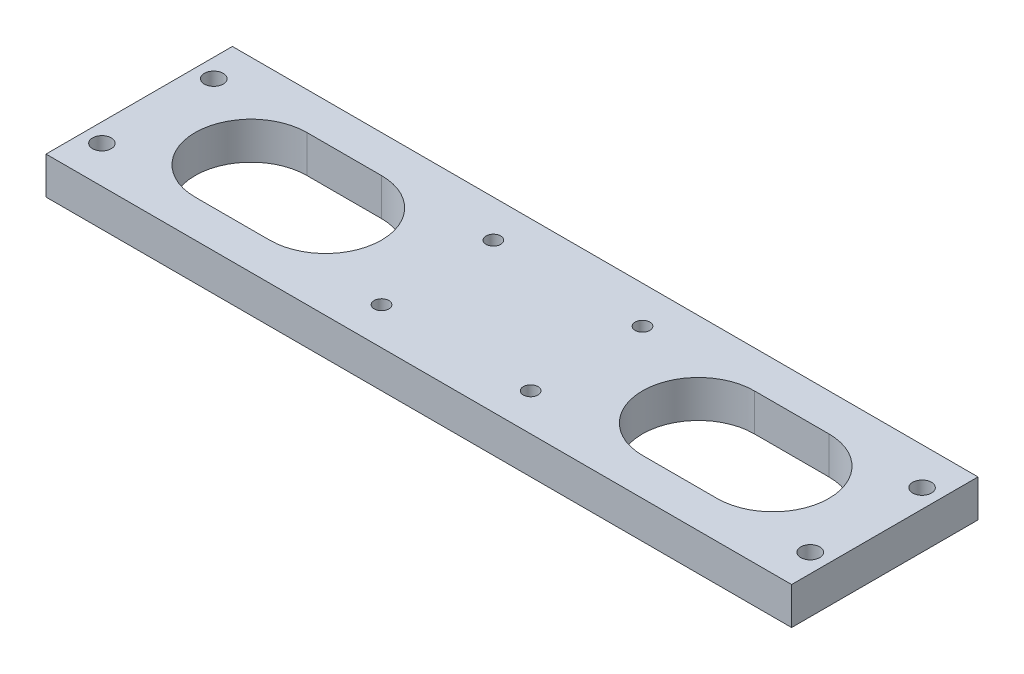
from build123d import *

# Parameters (mm, degrees)
SKETCH1_W                                       = 127
SKETCH1_H                                       = 31.75
BOSS_EXTRUDE1_DEPTH                             = 3.175
CSK_FOR_M3_FLAT_HEAD_MACHINE_SCREW1_D           = 3.2
CSK_FOR_M3_FLAT_HEAD_MACHINE_SCREW1_DEPTH       = 12.7
CSK_FOR_M3_FLAT_HEAD_MACHINE_SCREW1_CSINK_D     = 6.3
CSK_FOR_M3_FLAT_HEAD_MACHINE_SCREW1_CSINK_ANGLE = 90
CSK_FOR_M3_FLAT_HEAD_MACHINE_SCREW1_TIP         = 0.96137699
M3X0_5_TAPPED_HOLE1_D                           = 2.5
CUT_EXTRUDE1_DEPTH                              = 66.761600688


with BuildPart() as part:
    # Sketch1 → Boss-Extrude1 (new, symmetric)
    with BuildSketch(Plane(origin=(0, 0, 0), x_dir=(1, 0, 0), z_dir=(0, 1, 0))):
        Rectangle(SKETCH1_W, SKETCH1_H)
    extrude(amount=BOSS_EXTRUDE1_DEPTH, both=True)

    # CSK for M3 Flat Head Machine Screw1
    with Locations(Plane(origin=(0, -3.175, 0), x_dir=(-1, 0, 0), z_dir=(0, -1, 0))):
        with Locations((60.325, 9.525), (60.325, -9.525), (-60.325, -9.525), (-60.325, 9.525)):
            CounterSinkHole(CSK_FOR_M3_FLAT_HEAD_MACHINE_SCREW1_D / 2, CSK_FOR_M3_FLAT_HEAD_MACHINE_SCREW1_CSINK_D / 2, depth=CSK_FOR_M3_FLAT_HEAD_MACHINE_SCREW1_DEPTH, counter_sink_angle=CSK_FOR_M3_FLAT_HEAD_MACHINE_SCREW1_CSINK_ANGLE)
            with Locations((0, 0, -(CSK_FOR_M3_FLAT_HEAD_MACHINE_SCREW1_DEPTH + CSK_FOR_M3_FLAT_HEAD_MACHINE_SCREW1_TIP / 2))):  # 118° drill point
                Cone(0, CSK_FOR_M3_FLAT_HEAD_MACHINE_SCREW1_D / 2, CSK_FOR_M3_FLAT_HEAD_MACHINE_SCREW1_TIP, mode=Mode.SUBTRACT)

    # M3x0.5 Tapped Hole1 (through all)
    with Locations(Plane(origin=(0, 3.175, 0), x_dir=(1, 0, 0), z_dir=(0, 1, 0))):
        with Locations((-12.7, 9.525), (12.7, 9.525), (12.7, -9.525), (-12.7, -9.525)):
            Hole(M3X0_5_TAPPED_HOLE1_D / 2)

    # Sketch10 → Cut-Extrude1 (cut, through all)
    with BuildSketch(Plane(origin=(0, 3.175, 0), x_dir=(1, 0, 0), z_dir=(0, 1, 0))):
        with BuildLine():
            Line((-44.45, 9.525), (-31.75, 9.525))
            ThreePointArc((-31.75, 9.525), (-22.225, 0), (-31.75, -9.525))
            Line((-31.75, -9.525), (-44.45, -9.525))
            ThreePointArc((-44.45, -9.525), (-53.975, 0), (-44.45, 9.525))
        make_face()
        with BuildLine():
            Line((44.45, -9.525), (31.75, -9.525))
            ThreePointArc((31.75, -9.525), (22.225, 0), (31.75, 9.525))
            Line((31.75, 9.525), (44.45, 9.525))
            ThreePointArc((44.45, 9.525), (53.975, 0), (44.45, -9.525))
        make_face()
    extrude(amount=-CUT_EXTRUDE1_DEPTH, mode=Mode.SUBTRACT)


solid = part.part
